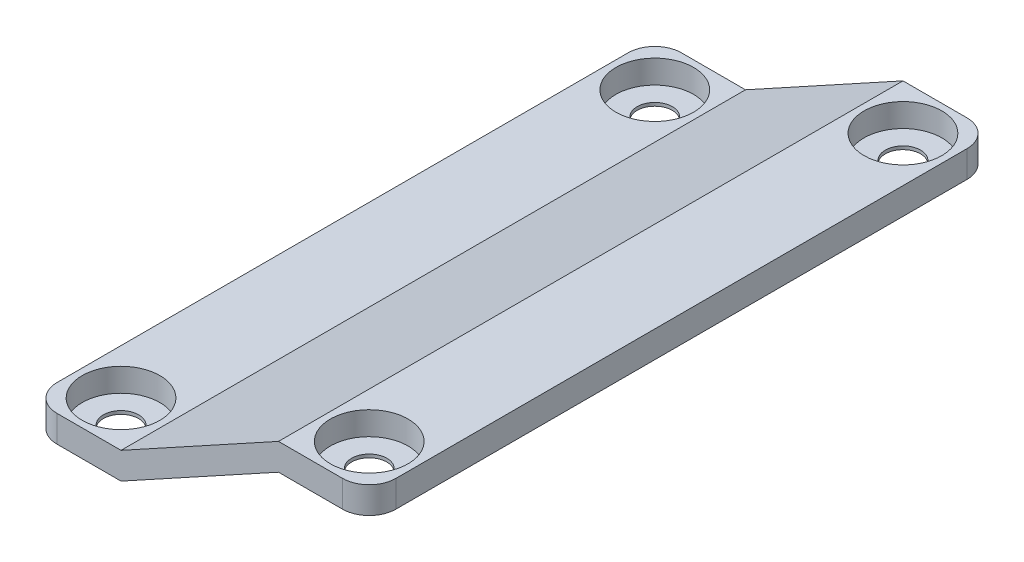
from build123d import *

# Parameters (mm, degrees)
COVER_BODY_DEPTH                        = 117
CBORE_FOR_M6_HEX_HEAD_BOLT1_D           = 6.6
CBORE_FOR_M6_HEX_HEAD_BOLT1_CBORE_D     = 14.55
CBORE_FOR_M6_HEX_HEAD_BOLT1_CBORE_DEPTH = 4.38
CBORE_FOR_M6_HEX_HEAD_BOLT2_D           = 6.6
CBORE_FOR_M6_HEX_HEAD_BOLT2_CBORE_D     = 14.55
CBORE_FOR_M6_HEX_HEAD_BOLT2_CBORE_DEPTH = 4.38
FILLET1_R                               = 5


with BuildPart() as part:
    # Sketch1 → Cover Body (new body)
    with BuildSketch(Plane.XY):
        Polygon((-15.007754177, -4.568983292), (14.492245823, 11.631016708), (31.492245823, 11.631016708), (31.492245823, 6.631016708), (14.492245823, 6.631016708), (-15.007754177, -9.568983292), (-32.007754177, -9.568983292), (-32.007754177, -4.568983292), align=None)
    extrude(amount=-COVER_BODY_DEPTH)

    # CBORE for M6 Hex Head Bolt1 (through all)
    with Locations(Plane(origin=(0, -4.568983292, 0), x_dir=(1, 0, 0), z_dir=(0, 1, 0))):
        with Locations((-23.507754177, 108.5), (-23.507754177, 8.5)):
            CounterBoreHole(CBORE_FOR_M6_HEX_HEAD_BOLT1_D / 2, CBORE_FOR_M6_HEX_HEAD_BOLT1_CBORE_D / 2, CBORE_FOR_M6_HEX_HEAD_BOLT1_CBORE_DEPTH)

    # CBORE for M6 Hex Head Bolt2 (through all)
    with Locations(Plane(origin=(0, 11.631016708, 0), x_dir=(1, 0, 0), z_dir=(0, 1, 0))):
        with Locations((22.992245823, 8.5), (22.992245823, 108.5)):
            CounterBoreHole(CBORE_FOR_M6_HEX_HEAD_BOLT2_D / 2, CBORE_FOR_M6_HEX_HEAD_BOLT2_CBORE_D / 2, CBORE_FOR_M6_HEX_HEAD_BOLT2_CBORE_DEPTH)

    # Fillet1
    fillet1_edges = [part.edges().sort_by_distance(p)[0] for p in [
        (31.492245823, 9.131016708, 0),
        (31.492245823, 9.131016708, -117),
        (-32.007754177, -7.068983292, -117),
        (-32.007754177, -7.068983292, 0),
    ]]
    fillet(fillet1_edges, radius=FILLET1_R)


solid = part.part
